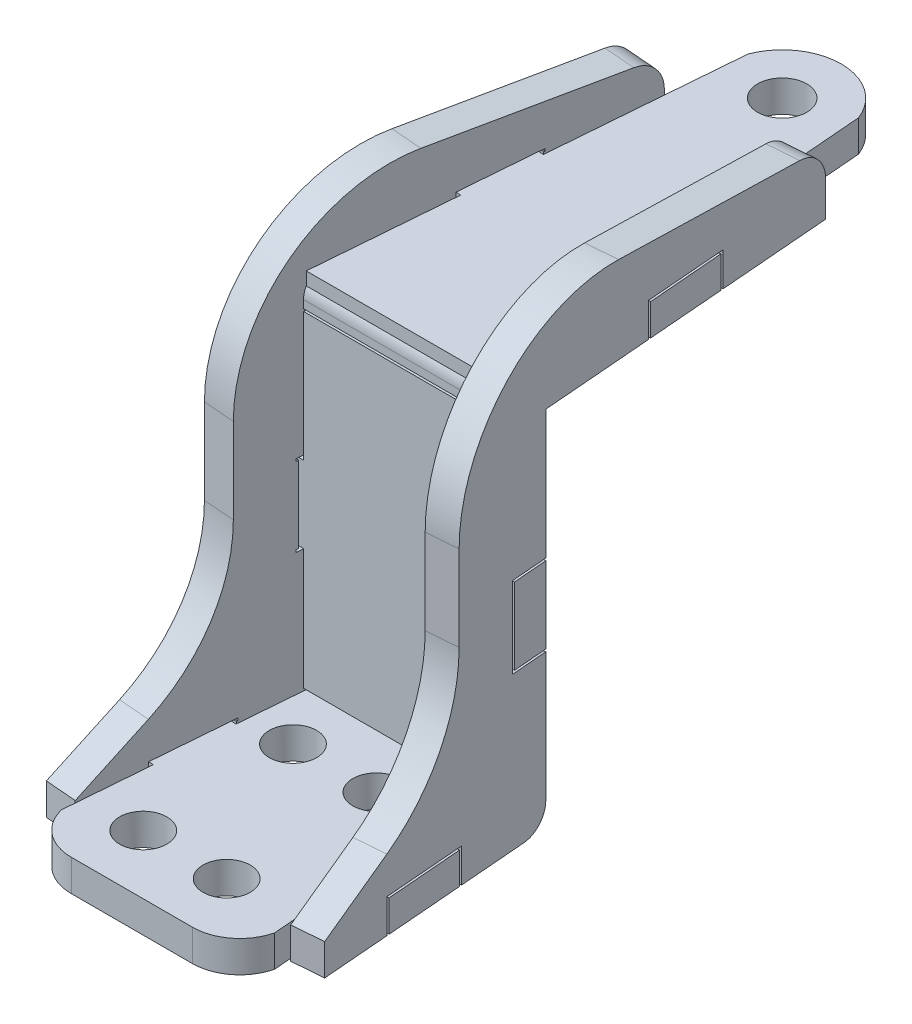
from build123d import *

# Parameters (mm, degrees)
EXTRUDE_THIN1_DEPTH             = 15
SKETCH2_R                       = 3.125
SKETCH2_R_2                     = 3
CUT_EXTRUDE1_DEPTH              = 105.043260233
FILLET1_R                       = 6
BOSS_EXTRUDE1_DEPTH             = 4
CUT_EXTRUDE_THIN1_DEPTH         = 104.516638951
CUT_EXTRUDE_THIN1_DEPTH_BACK    = 104.516638951
SKETCH9_W                       = 10
SKETCH9_H                       = 0.3
SKETCH9_W_2                     = 0.3
SKETCH9_H_2                     = 10
SKETCH10_W                      = 0.3
SKETCH10_H                      = 6.641398284
SKETCH10_H_2                    = 6.68977618
SKETCH10_H_3                    = 6.232858904
SKETCH10_W_2                    = 7.476045761
SKETCH10_H_4                    = 0.3
SKETCH10_W_3                    = 11.836568253
SKETCH10_H_5                    = 6.233569927
CUT_EXTRUDE_THIN2_DEPTH         = 4.3
SKETCH11_R                      = 56.701195511
SKETCH11_W                      = 9.732603568
SKETCH11_H                      = 4
SKETCH11_W_2                    = 4.336308338
SKETCH11_H_2                    = 9.7
CUT_EXTRUDE2_DEPTH              = 0.3
BOSS_EXTRUDE2_REACH             = 105.517
SKETCH12_W                      = 4
SKETCH12_H                      = 4
BOSS_EXTRUDE2_DIRECTION_2_REACH = 105.517
CUT_EXTRUDE3_DEPTH              = 0.3
CUT_EXTRUDE4_DEPTH              = 0.3
CUT_EXTRUDE_THIN3_DEPTH         = 104.516638951
CUT_EXTRUDE_THIN3_DEPTH_BACK    = 104.516638951
SKETCH13_W                      = 26.058456106
SKETCH13_H                      = 0.3
SKETCH13_W_2                    = 36.049711327


with BuildPart() as part:
    # Sketch1 → Extrude-Thin1 (new, symmetric)
    with BuildSketch(Plane(origin=(0, 0, 0), x_dir=(0, 0, -1), z_dir=(1, 0, 0))):
        with BuildLine():
            Line((0, 2), (-54, 2))
            ThreePointArc((-54, 2), (-56.121320344, 1.121320344), (-57, -1))
            Line((-57, -1), (-57, -44))
            Line((-57, -44), (-90, -44))
            Line((-90, -44), (-90, -48))
            Line((-90, -48), (-56, -48))
            ThreePointArc((-56, -48), (-53.878679656, -47.121320344), (-53, -45))
            Line((-53, -45), (-53, -2))
            Line((-53, -2), (0, -2))
            Line((0, -2), (0, 2))
        make_face()
    extrude(amount=EXTRUDE_THIN1_DEPTH, both=True)

    # Sketch2 → Cut-Extrude1 (cut, through all)
    with BuildSketch(Plane(origin=(0, 2, 0), x_dir=(1, 0, 0), z_dir=(0, 1, 0))):
        with Locations(Location((0, -7.5, 0), (0, 0, 270))):
            Circle(SKETCH2_R)
        with Locations(Location((-6.061254587, -82.5, 0), (0, 0, 270))):
            Circle(SKETCH2_R_2)
        with Locations(Location((-6.061254587, -63.5, 0), (0, 0, 270))):
            Circle(SKETCH2_R_2)
        with Locations(Location((4.525736758, -82.5, 0), (0, 0, 270))):
            Circle(SKETCH2_R_2)
        with Locations(Location((4.525736758, -63.5, 0), (0, 0, 270))):
            Circle(SKETCH2_R_2)
        with BuildLine():
            Line((-7.475626789, -6.895844304), (-15, -100))
            Line((-15, -100), (-17.60021431, 8.448336275))
            Line((-17.60021431, 8.448336275), (38.426582869, 9.42947631))
            Line((38.426582869, 9.42947631), (15, -100))
            Line((15, -100), (7.475626789, -6.895844304))
            ThreePointArc((7.475626789, -6.895844304), (0, 0), (-7.475626789, -6.895844304))
        make_face()
    extrude(amount=-CUT_EXTRUDE1_DEPTH, mode=Mode.SUBTRACT)

    # Fillet1
    fillet1_edges = [part.edges().sort_by_distance(p)[0] for p in [
        (-14.191832722, -46, 90),
        (14.191832722, -46, 90),
    ]]
    fillet(fillet1_edges, radius=FILLET1_R)

    # Sketch8 → Boss-Extrude1 (add)
    with BuildSketch(Plane(origin=(6.873434456, 0, -0.555488482), x_dir=(-0.08055409274536145, 0, -0.9967502385963958), z_dir=(0.9967502385963958, 0, -0.08055409274536145))):
        with BuildLine():
            Line((-56.739879552, -48), (-84.346269175, -48))
            Line((-84.346269175, -48), (-84.346269175, -44))
            Line((-84.346269175, -44), (-75.730098482, -39.025451531))
            ThreePointArc((-75.730098482, -39.025451531), (-68.409590406, -31.704943455), (-65.730098482, -21.704943455))
            Line((-65.730098482, -21.704943455), (-65.730098482, -10.883213246))
            ThreePointArc((-65.730098482, -10.883213246), (-59.11411389, 3.978419624), (-43.643285327, 9.007619086))
            Line((-43.643285327, 9.007619086), (-18.558264158, 6.375866362))
            ThreePointArc((-18.558264158, 6.375866362), (-16.003300216, 5.074502978), (-14.975626789, 2.397699896))
            Line((-14.975626789, 2.397699896), (-14.975626789, 2))
            Line((-14.975626789, 2), (-14.975626789, -2))
            Line((-14.975626789, -2), (-53.730098482, -2))
            Line((-53.730098482, -2), (-53.730098482, -45))
            add(Edge.make_bspline(
                [(-56.739879552, -48), (-53.730098482, -48), (-53.730098482, -45)],
                knots=[4.71238898, 4.71238898, 4.71238898, 6.283185307, 6.283185307, 6.283185307], degree=2, weights=[1, 0.707106781, 1]))
        make_face()
    boss_extrude1 = extrude(amount=BOSS_EXTRUDE1_DEPTH)

    # Mirror1: Boss-Extrude1 across plane
    add(boss_extrude1.mirror(Plane(origin=(0, 0, 0), x_dir=(0, 0, 1), z_dir=(1, 0, 0))))

    # Sketch9 → Cut-Extrude-Thin1 (cut, two sides: drawn at the far end of the back side and taken through both)
    with BuildSketch(Plane(origin=(0, 0, 0), x_dir=(0, 0, -1), z_dir=(1, 0, 0)).offset(-CUT_EXTRUDE_THIN1_DEPTH_BACK)):
        with Locations((-33.363519176, 2.15)):
            Rectangle(SKETCH9_W, SKETCH9_H)
        with Locations((-57.15, -23.5)):
            Rectangle(SKETCH9_W_2, SKETCH9_H_2)
        with Locations((-69.436121351, -43.85)):
            Rectangle(SKETCH9_W, SKETCH9_H)
    extrude(amount=CUT_EXTRUDE_THIN1_DEPTH + CUT_EXTRUDE_THIN1_DEPTH_BACK, mode=Mode.SUBTRACT)

    # Sketch10 → Cut-Extrude-Thin2 (cut)
    with BuildSketch(Plane(origin=(-10.86043541, 0, -0.877704853), x_dir=(-0.08055409274536145, 0, 0.9967502385963957), z_dir=(-0.9967502385963957, 0, -0.08055409274536145))):
        with Locations((29.336560852, -1.020699142)):
            Rectangle(SKETCH10_W, SKETCH10_H)
        with Locations((39.36916442, -1.04488809)):
            Rectangle(SKETCH10_W, SKETCH10_H_2)
        with Locations((65.52677258, -46.816429452)):
            Rectangle(SKETCH10_W, SKETCH10_H_3)
        with Locations((54.629362047, -18.5)):
            Rectangle(SKETCH10_W_2, SKETCH10_H_4)
        with Locations((52.449100801, -28.5)):
            Rectangle(SKETCH10_W_3, SKETCH10_H_4)
        with Locations((75.559376148, -46.816784963)):
            Rectangle(SKETCH10_W, SKETCH10_H_5)
    cut_extrude_thin2 = extrude(amount=-CUT_EXTRUDE_THIN2_DEPTH, mode=Mode.SUBTRACT)

    # Sketch11 → Cut-Extrude2 (cut)
    with BuildSketch(Plane(origin=(-6.574409384, 0, -0.531322254), x_dir=(-0.08055409274536145, 0, 0.9967502385963957), z_dir=(-0.9967502385963957, 0, -0.08055409274536145))):
        with Locations((49.164522952, -12.48660382)):
            Circle(SKETCH11_R)
        with Locations((34.352862636, 0)):
            Rectangle(SKETCH11_W, SKETCH11_H, mode=Mode.SUBTRACT)
        with Locations((55.898252651, -23.5)):
            Rectangle(SKETCH11_W_2, SKETCH11_H_2, mode=Mode.SUBTRACT)
        with Locations((70.543074364, -46)):
            Rectangle(SKETCH11_W, SKETCH11_H, mode=Mode.SUBTRACT)
    cut_extrude2 = extrude(amount=CUT_EXTRUDE2_DEPTH, mode=Mode.SUBTRACT)

    # Mirror2: Cut-Extrude-Thin2 across plane
    add(cut_extrude_thin2.mirror(Plane(origin=(0, 0, 0), x_dir=(0, 0, 1), z_dir=(1, 0, 0))), mode=Mode.SUBTRACT)

    # Mirror3: Cut-Extrude2 across plane
    add(cut_extrude2.mirror(Plane(origin=(0, 0, 0), x_dir=(0, 0, 1), z_dir=(1, 0, 0))), mode=Mode.SUBTRACT)

    # Boss-Extrude2: up to this plane
    boss_extrude2_end = Plane(origin=(-6.574409384, 0, -0.531322254), z_dir=(0.9967502385963957, 0, 0.08055409274536145))
    # Sketch12 → Boss-Extrude2 (add, up to the surface)
    with BuildSketch(Plane(origin=(0, 0, 0), x_dir=(0, 0, -1), z_dir=(1, 0, 0)), mode=Mode.PRIVATE) as boss_extrude2_sk1:
        with Locations((-54.677783629, 0)):
            Rectangle(SKETCH12_W, SKETCH12_H)
    boss_extrude2_tool1 = split(extrude(boss_extrude2_sk1.sketch, amount=-BOSS_EXTRUDE2_REACH, mode=Mode.PRIVATE), bisect_by=boss_extrude2_end, keep=Keep.BOTH, mode=Mode.PRIVATE)
    add(boss_extrude2_tool1.solids().sort_by_distance((0, 0, 54.677784))[0])
    # Sketch12 → Boss-Extrude2 (add, up to the surface)
    with BuildSketch(Plane(origin=(0, 0, 0), x_dir=(0, 0, -1), z_dir=(1, 0, 0)), mode=Mode.PRIVATE) as boss_extrude2_sk2:
        with Locations((-55, -46)):
            Rectangle(SKETCH12_W, SKETCH12_H)
    boss_extrude2_tool2 = split(extrude(boss_extrude2_sk2.sketch, amount=-BOSS_EXTRUDE2_REACH, mode=Mode.PRIVATE), bisect_by=boss_extrude2_end, keep=Keep.BOTH, mode=Mode.PRIVATE)
    add(boss_extrude2_tool2.solids().sort_by_distance((0, -46, 55))[0])

    # Boss-Extrude2 direction 2: up to this plane
    boss_extrude2_direction_2_end = Plane(origin=(6.574409384, 0, -0.531322254), z_dir=(-0.9967502385963957, 0, 0.08055409274536145))
    # Sketch12 → Boss-Extrude2 direction 2 (add, up to the surface)
    with BuildSketch(Plane(origin=(0, 0, 0), x_dir=(0, 0, -1), z_dir=(1, 0, 0)), mode=Mode.PRIVATE) as boss_extrude2_direction_2_sk1:
        with Locations((-54.677783629, 0)):
            Rectangle(SKETCH12_W, SKETCH12_H)
    boss_extrude2_direction_2_tool1 = split(extrude(boss_extrude2_direction_2_sk1.sketch, amount=BOSS_EXTRUDE2_DIRECTION_2_REACH, mode=Mode.PRIVATE), bisect_by=boss_extrude2_direction_2_end, keep=Keep.BOTH, mode=Mode.PRIVATE)
    add(boss_extrude2_direction_2_tool1.solids().sort_by_distance((0, 0, 54.677784))[0])
    # Sketch12 → Boss-Extrude2 direction 2 (add, up to the surface)
    with BuildSketch(Plane(origin=(0, 0, 0), x_dir=(0, 0, -1), z_dir=(1, 0, 0)), mode=Mode.PRIVATE) as boss_extrude2_direction_2_sk2:
        with Locations((-55, -46)):
            Rectangle(SKETCH12_W, SKETCH12_H)
    boss_extrude2_direction_2_tool2 = split(extrude(boss_extrude2_direction_2_sk2.sketch, amount=BOSS_EXTRUDE2_DIRECTION_2_REACH, mode=Mode.PRIVATE), bisect_by=boss_extrude2_direction_2_end, keep=Keep.BOTH, mode=Mode.PRIVATE)
    add(boss_extrude2_direction_2_tool2.solids().sort_by_distance((0, -46, 55))[0])

    # Sketch14 → Cut-Extrude3 (cut)
    with BuildSketch(Plane(origin=(0, -44, 0), x_dir=(1, 0, 0), z_dir=(0, 1, 0))):
        Polygon((-6.486159071, -72.877526277), (-16.895928913, -72.553711619), (-16.959135518, -74.585633887), (-6.549365677, -74.909448545), align=None)
        Polygon((6.549365677, -74.909448545), (16.959135518, -74.585633887), (16.895928913, -72.553711619), (6.486159071, -72.877526277), align=None)
    extrude(amount=CUT_EXTRUDE3_DEPTH, mode=Mode.SUBTRACT)

    # Sketch15 → Cut-Extrude4 (cut)
    with BuildSketch(Plane(origin=(0, 2, 0), x_dir=(1, 0, 0), z_dir=(0, 1, 0))):
        Polygon((14.263002683, -38.29994084), (-15.974696203, -38.054570408), (0.914390447, -39.969172337), align=None)
    extrude(amount=CUT_EXTRUDE4_DEPTH, mode=Mode.SUBTRACT)


with BuildPart() as cut_extrude4_piece_1:
    # of the separate pieces the step leaves, piece 1, a body of its own (cut_extrude4_pieces)
    add(part.part.solids().sort_by_distance((-7.687370214, -48, 90))[0])

    # Sketch13 → Cut-Extrude-Thin3 (cut, two sides: drawn at the far end of the back side and taken through both)
    with BuildSketch(Plane(origin=(0, 0, 0), x_dir=(0, 0, -1), z_dir=(1, 0, 0)).offset(-CUT_EXTRUDE_THIN3_DEPTH_BACK)):
        with Locations((-62.775931951, -43.85)):
            Rectangle(SKETCH13_W, SKETCH13_H)
        with Locations((-61.935402371, -2.15)):
            Rectangle(SKETCH13_W_2, SKETCH13_H)
    extrude(amount=CUT_EXTRUDE_THIN3_DEPTH + CUT_EXTRUDE_THIN3_DEPTH_BACK, mode=Mode.SUBTRACT)


with BuildPart() as cut_extrude4_piece_2:
    # of the separate pieces the step leaves, piece 2, a body of its own (cut_extrude4_pieces)
    add(part.part.solids().sort_by_distance((-11.201613792, -28.65, 53))[0])


with BuildPart() as cut_extrude4_piece_3:
    # of the separate pieces the step leaves, piece 3, a body of its own (cut_extrude4_pieces)
    add(part.part.solids().sort_by_distance((14.043865846, 2.3, 38.513031712))[0])


with BuildPart() as cut_extrude_thin3_piece_1:
    # of the separate pieces the step leaves, piece 1, a body of its own (cut_extrude_thin3_pieces)
    add(cut_extrude4_piece_1.part.solids().sort_by_distance((-9.733673592, -2, 38.560389239))[0])


with BuildPart() as cut_extrude_thin3_piece_2:
    # of the separate pieces the step leaves, piece 2, a body of its own (cut_extrude_thin3_pieces)
    add(cut_extrude4_piece_1.part.solids().sort_by_distance((-10.900635685, -43.7, 53))[0])


with BuildPart() as cut_extrude_thin3_piece_3:
    # of the separate pieces the step leaves, piece 3, a body of its own (cut_extrude_thin3_pieces)
    add(cut_extrude4_piece_1.part.solids().sort_by_distance((-7.687370214, -48, 90))[0])


solid = Compound([cut_extrude4_piece_2.part, cut_extrude4_piece_3.part, cut_extrude_thin3_piece_1.part, cut_extrude_thin3_piece_2.part, cut_extrude_thin3_piece_3.part])
